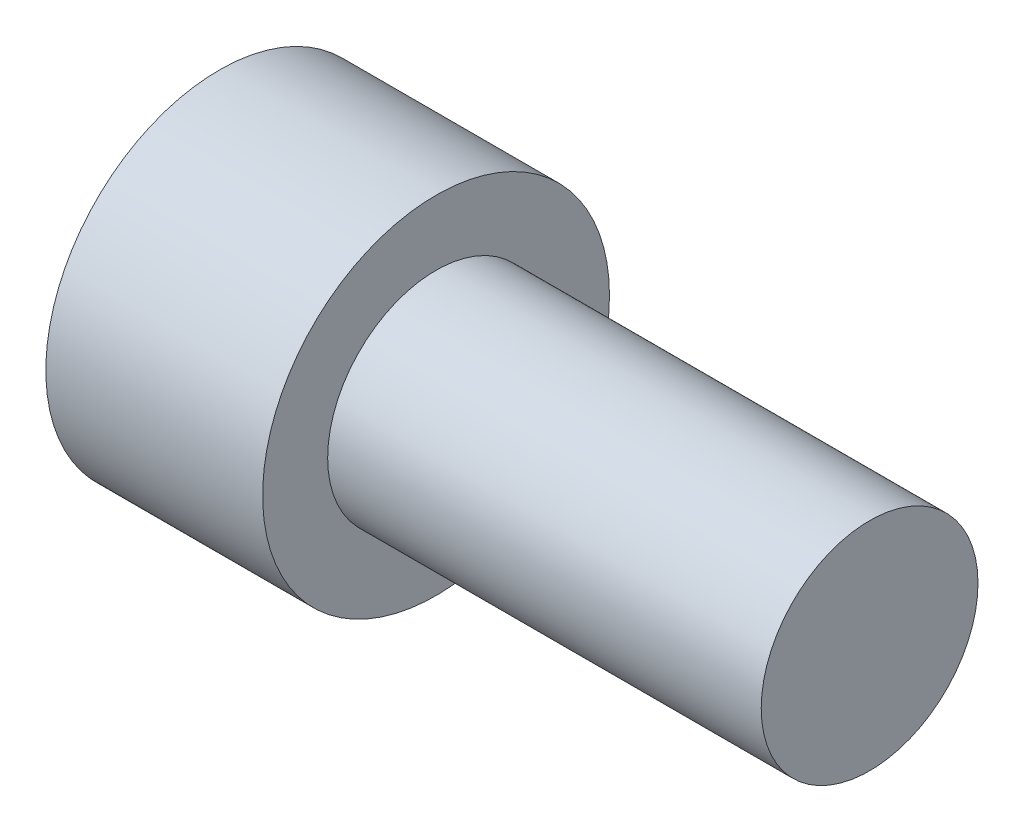
from build123d import *

# Parameters (mm, degrees)
SKETCH_1_R      = 8
EXTRUDE_1_DEPTH = 10
SKETCH_2_R      = 5
EXTRUDE_2_DEPTH = 20


with BuildPart() as part:
    # 草图1 → 凸台-拉伸1 (new body)
    with BuildSketch(Plane(origin=(0, 0, 0), x_dir=(0, 0, -1), z_dir=(1, 0, 0))):
        Circle(SKETCH_1_R)
    extrude(amount=EXTRUDE_1_DEPTH)

    # 草图2 → 凸台-拉伸2 (add)
    with BuildSketch(Plane(origin=(10, 0, 0), x_dir=(0, 0, -1), z_dir=(1, 0, 0))):
        Circle(SKETCH_2_R)
    extrude(amount=EXTRUDE_2_DEPTH)


solid = part.part
